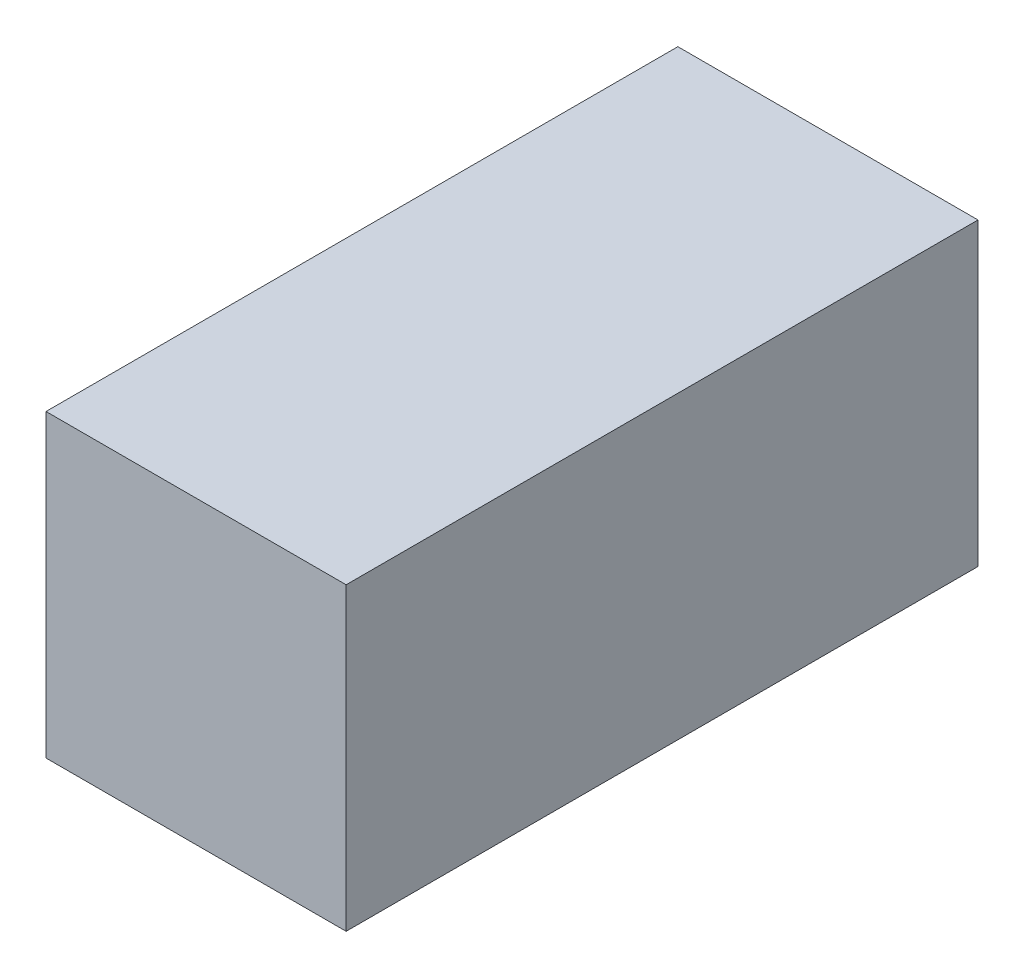
from build123d import *

# Parameters (mm, degrees)
SKETCH_1_W      = 13.3
SKETCH_1_H      = 13.3
EXTRUDE_1_DEPTH = 28


with BuildPart() as part:
    # Эскиз1 → Бобышка-Вытянуть1 (new body)
    with BuildSketch(Plane.XY):
        Rectangle(SKETCH_1_W, SKETCH_1_H)
    extrude(amount=EXTRUDE_1_DEPTH)


solid = part.part
